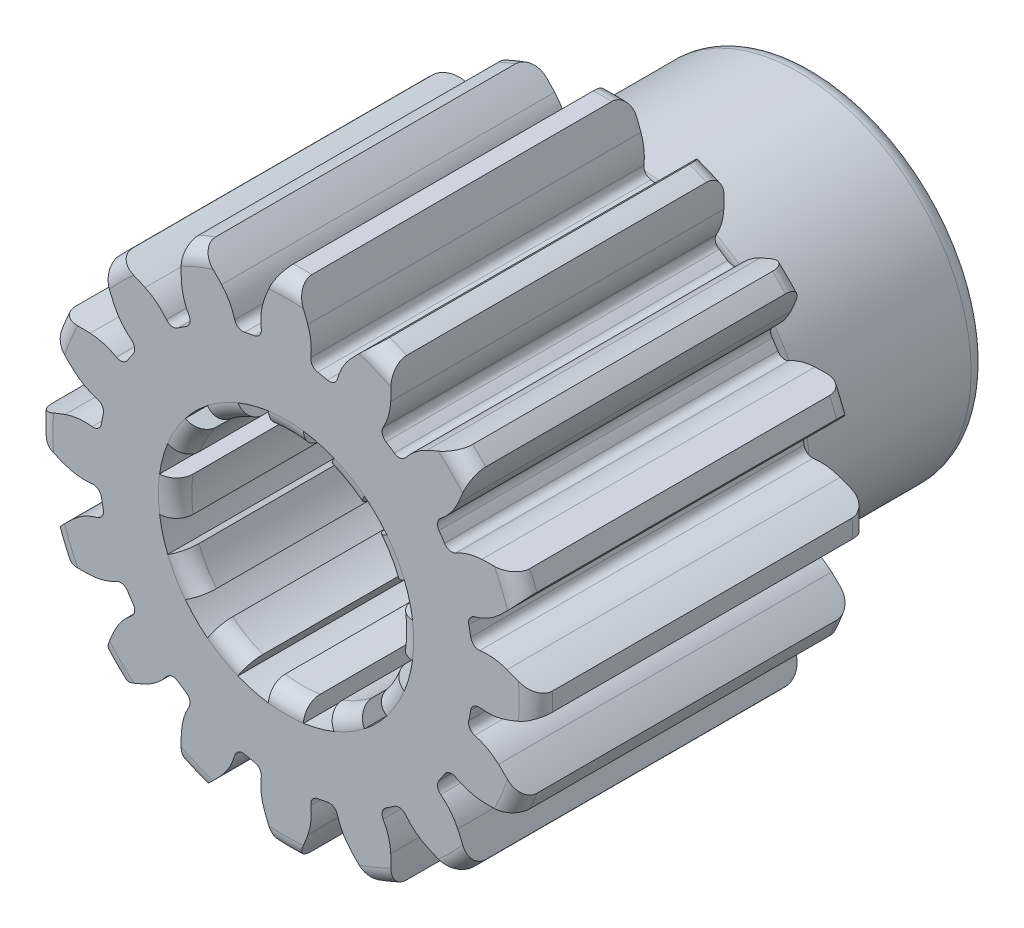
from build123d import *

# Parameters (mm, degrees)
CUT_EXTRUDE1_DEPTH = 73.71523613
CIRPATTERN1_COUNT  = 16
CUT_EXTRUDE2_REACH = 74.715


with BuildPart() as part:
    # Sketch3 → Revolve1 (revolve)
    with BuildSketch(Plane(origin=(0, 0, 0), x_dir=(0, 0, -1), z_dir=(1, 0, 0)), mode=Mode.PRIVATE) as revolve1_sk:
        with BuildLine():
            Line((28.321, 12.7), (-28.321, 12.7))
            ThreePointArc((-28.321, 12.7), (-29.668038418, 13.257961582), (-30.226, 14.605))
            Line((-30.226, 14.605), (-30.226, 26.67))
            ThreePointArc((-30.226, 26.67), (-29.668038418, 28.017038418), (-28.321, 28.575))
            Line((-28.321, 28.575), (5.969, 28.575))
            ThreePointArc((5.969, 28.575), (7.316038418, 28.017038418), (7.874, 26.67))
            Line((7.874, 26.67), (7.874, 21.717))
            ThreePointArc((7.874, 21.717), (8.431961582, 20.369961582), (9.779, 19.812))
            Line((9.779, 19.812), (28.321, 19.812))
            ThreePointArc((28.321, 19.812), (29.668038418, 19.254038418), (30.226, 17.907))
            Line((30.226, 17.907), (30.226, 14.605))
            ThreePointArc((30.226, 14.605), (29.668038418, 13.257961582), (28.321, 12.7))
        make_face()
    revolve(revolve1_sk.sketch.rotate(Axis((0, 0, -30.226), (0, 0, 1)), 90), axis=Axis((0, 0, -30.226), (0, 0, 1)))

    # Sketch4 → Cut-Extrude1 (cut, symmetric)
    with BuildSketch(Plane.XY.offset(30.226)):
        with BuildLine():
            ThreePointArc((9.954074785, 26.785201514), (5.574705952, 28.025939388), (1.053886893, 28.555558958))
            ThreePointArc((1.053886893, 28.555558958), (1.824044526, 26.93952485), (2.489641168, 25.277691486))
            ThreePointArc((2.489641168, 25.277691486), (2.847143045, 23.751026765), (2.834519928, 22.18311305))
            ThreePointArc((2.834519928, 22.18311305), (3.013653222, 21.495832145), (3.618515105, 21.123560898))
            ThreePointArc((3.618515105, 21.123560898), (4.181029464, 21.019454541), (4.740564744, 20.900371348))
            ThreePointArc((4.740564744, 20.900371348), (5.441846297, 21.012834513), (5.870354897, 21.579247929))
            ThreePointArc((5.870354897, 21.579247929), (6.45870726, 23.032641977), (7.373225222, 24.30628622))
            ThreePointArc((7.373225222, 24.30628622), (8.624112432, 25.586907244), (9.954074785, 26.785201514))
        make_face()
    cut_extrude1 = extrude(amount=CUT_EXTRUDE1_DEPTH, both=True, mode=Mode.SUBTRACT)

    # CirPattern1: Cut-Extrude1 ×16 about axis
    cirpattern1_axis = Axis((0, 0, 0), (0, 0, 1))
    for i in range(1, CIRPATTERN1_COUNT):
        add(cut_extrude1.rotate(cirpattern1_axis, i * 360 / CIRPATTERN1_COUNT), mode=Mode.SUBTRACT)

    # Sketch5 → Cut-Extrude2 (cut, up to next)
    with BuildSketch(Plane(origin=(0, 0, -30.226), x_dir=(-1, 0, 0), z_dir=(0, 0, -1)), mode=Mode.PRIVATE) as cut_extrude2_sk1:
        with BuildLine():
            ThreePointArc((5.501655452, 13.529146769), (3.780052154, 14.107346693), (2, 14.467412519))
            Line((2, 14.467412519), (2, 12.541531007))
            ThreePointArc((2, 12.541531007), (3.287001873, 12.267257994), (4.538714696, 11.861284454))
            Line((4.538714696, 11.861284454), (5.501655452, 13.529146769))
        make_face()
    cut_extrude2_tool1 = extrude(cut_extrude2_sk1.sketch, amount=-CUT_EXTRUDE2_REACH, mode=Mode.PRIVATE) & part.part
    # Sketch5 → Cut-Extrude2 (cut, up to next)
    with BuildSketch(Plane(origin=(0, 0, -30.226), x_dir=(-1, 0, 0), z_dir=(0, 0, -1)), mode=Mode.PRIVATE) as cut_extrude2_sk2:
        with BuildLine():
            ThreePointArc((11.529146769, 8.965757067), (10.327294539, 10.327294539), (8.965757067, 11.529146769))
            Line((8.965757067, 11.529146769), (8.002816311, 9.861284454))
            ThreePointArc((8.002816311, 9.861284454), (8.980256121, 8.980256121), (9.861284454, 8.002816311))
            Line((9.861284454, 8.002816311), (11.529146769, 8.965757067))
        make_face()
    cut_extrude2_tool2 = extrude(cut_extrude2_sk2.sketch, amount=-CUT_EXTRUDE2_REACH, mode=Mode.PRIVATE) & part.part
    # Sketch5 → Cut-Extrude2 (cut, up to next)
    with BuildSketch(Plane(origin=(0, 0, -30.226), x_dir=(-1, 0, 0), z_dir=(0, 0, -1)), mode=Mode.PRIVATE) as cut_extrude2_sk3:
        with BuildLine():
            ThreePointArc((14.467412519, 2), (14.107346693, 3.780052154), (13.529146769, 5.501655452))
            Line((13.529146769, 5.501655452), (11.861284454, 4.538714696))
            ThreePointArc((11.861284454, 4.538714696), (12.267257994, 3.287001873), (12.541531007, 2))
            Line((12.541531007, 2), (14.467412519, 2))
        make_face()
    cut_extrude2_tool3 = extrude(cut_extrude2_sk3.sketch, amount=-CUT_EXTRUDE2_REACH, mode=Mode.PRIVATE) & part.part
    # Sketch5 → Cut-Extrude2 (cut, up to next)
    with BuildSketch(Plane(origin=(0, 0, -30.226), x_dir=(-1, 0, 0), z_dir=(0, 0, -1)), mode=Mode.PRIVATE) as cut_extrude2_sk4:
        with BuildLine():
            ThreePointArc((13.529146769, -5.501655452), (14.107346693, -3.780052154), (14.467412519, -2))
            Line((14.467412519, -2), (12.541531007, -2))
            ThreePointArc((12.541531007, -2), (12.267257994, -3.287001873), (11.861284454, -4.538714696))
            Line((11.861284454, -4.538714696), (13.529146769, -5.501655452))
        make_face()
    cut_extrude2_tool4 = extrude(cut_extrude2_sk4.sketch, amount=-CUT_EXTRUDE2_REACH, mode=Mode.PRIVATE) & part.part
    # Sketch5 → Cut-Extrude2 (cut, up to next)
    with BuildSketch(Plane(origin=(0, 0, -30.226), x_dir=(-1, 0, 0), z_dir=(0, 0, -1)), mode=Mode.PRIVATE) as cut_extrude2_sk5:
        with BuildLine():
            ThreePointArc((8.965757067, -11.529146769), (10.327294539, -10.327294539), (11.529146769, -8.965757067))
            Line((11.529146769, -8.965757067), (9.861284454, -8.002816311))
            ThreePointArc((9.861284454, -8.002816311), (8.980256121, -8.980256121), (8.002816311, -9.861284454))
            Line((8.002816311, -9.861284454), (8.965757067, -11.529146769))
        make_face()
    cut_extrude2_tool5 = extrude(cut_extrude2_sk5.sketch, amount=-CUT_EXTRUDE2_REACH, mode=Mode.PRIVATE) & part.part
    # Sketch5 → Cut-Extrude2 (cut, up to next)
    with BuildSketch(Plane(origin=(0, 0, -30.226), x_dir=(-1, 0, 0), z_dir=(0, 0, -1)), mode=Mode.PRIVATE) as cut_extrude2_sk6:
        with BuildLine():
            ThreePointArc((2, -14.467412519), (3.780052154, -14.107346693), (5.501655452, -13.529146769))
            Line((5.501655452, -13.529146769), (4.538714696, -11.861284454))
            ThreePointArc((4.538714696, -11.861284454), (3.287001873, -12.267257994), (2, -12.541531007))
            Line((2, -12.541531007), (2, -14.467412519))
        make_face()
    cut_extrude2_tool6 = extrude(cut_extrude2_sk6.sketch, amount=-CUT_EXTRUDE2_REACH, mode=Mode.PRIVATE) & part.part
    # Sketch5 → Cut-Extrude2 (cut, up to next)
    with BuildSketch(Plane(origin=(0, 0, -30.226), x_dir=(-1, 0, 0), z_dir=(0, 0, -1)), mode=Mode.PRIVATE) as cut_extrude2_sk7:
        with BuildLine():
            Line((-4.538714696, -11.861284454), (-5.501655452, -13.529146769))
            ThreePointArc((-5.501655452, -13.529146769), (-3.780052154, -14.107346693), (-2, -14.467412519))
            Line((-2, -14.467412519), (-2, -12.541531007))
            ThreePointArc((-2, -12.541531007), (-3.287001873, -12.267257994), (-4.538714696, -11.861284454))
        make_face()
    cut_extrude2_tool7 = extrude(cut_extrude2_sk7.sketch, amount=-CUT_EXTRUDE2_REACH, mode=Mode.PRIVATE) & part.part
    # Sketch5 → Cut-Extrude2 (cut, up to next)
    with BuildSketch(Plane(origin=(0, 0, -30.226), x_dir=(-1, 0, 0), z_dir=(0, 0, -1)), mode=Mode.PRIVATE) as cut_extrude2_sk8:
        with BuildLine():
            Line((-9.861284454, -8.002816311), (-11.529146769, -8.965757067))
            ThreePointArc((-11.529146769, -8.965757067), (-10.327294539, -10.327294539), (-8.965757067, -11.529146769))
            Line((-8.965757067, -11.529146769), (-8.002816311, -9.861284454))
            ThreePointArc((-8.002816311, -9.861284454), (-8.980256121, -8.980256121), (-9.861284454, -8.002816311))
        make_face()
    cut_extrude2_tool8 = extrude(cut_extrude2_sk8.sketch, amount=-CUT_EXTRUDE2_REACH, mode=Mode.PRIVATE) & part.part
    # Sketch5 → Cut-Extrude2 (cut, up to next)
    with BuildSketch(Plane(origin=(0, 0, -30.226), x_dir=(-1, 0, 0), z_dir=(0, 0, -1)), mode=Mode.PRIVATE) as cut_extrude2_sk9:
        with BuildLine():
            Line((-12.541531007, -2), (-14.467412519, -2))
            ThreePointArc((-14.467412519, -2), (-14.107346693, -3.780052154), (-13.529146769, -5.501655452))
            Line((-13.529146769, -5.501655452), (-11.861284454, -4.538714696))
            ThreePointArc((-11.861284454, -4.538714696), (-12.267257994, -3.287001873), (-12.541531007, -2))
        make_face()
    cut_extrude2_tool9 = extrude(cut_extrude2_sk9.sketch, amount=-CUT_EXTRUDE2_REACH, mode=Mode.PRIVATE) & part.part
    # Sketch5 → Cut-Extrude2 (cut, up to next)
    with BuildSketch(Plane(origin=(0, 0, -30.226), x_dir=(-1, 0, 0), z_dir=(0, 0, -1)), mode=Mode.PRIVATE) as cut_extrude2_sk10:
        with BuildLine():
            Line((-11.861284454, 4.538714696), (-13.529146769, 5.501655452))
            ThreePointArc((-13.529146769, 5.501655452), (-14.107346693, 3.780052154), (-14.467412519, 2))
            Line((-14.467412519, 2), (-12.541531007, 2))
            ThreePointArc((-12.541531007, 2), (-12.267257994, 3.287001873), (-11.861284454, 4.538714696))
        make_face()
    cut_extrude2_tool10 = extrude(cut_extrude2_sk10.sketch, amount=-CUT_EXTRUDE2_REACH, mode=Mode.PRIVATE) & part.part
    # Sketch5 → Cut-Extrude2 (cut, up to next)
    with BuildSketch(Plane(origin=(0, 0, -30.226), x_dir=(-1, 0, 0), z_dir=(0, 0, -1)), mode=Mode.PRIVATE) as cut_extrude2_sk11:
        with BuildLine():
            Line((-8.002816311, 9.861284454), (-8.965757067, 11.529146769))
            ThreePointArc((-8.965757067, 11.529146769), (-10.327294539, 10.327294539), (-11.529146769, 8.965757067))
            Line((-11.529146769, 8.965757067), (-9.861284454, 8.002816311))
            ThreePointArc((-9.861284454, 8.002816311), (-8.980256121, 8.980256121), (-8.002816311, 9.861284454))
        make_face()
    cut_extrude2_tool11 = extrude(cut_extrude2_sk11.sketch, amount=-CUT_EXTRUDE2_REACH, mode=Mode.PRIVATE) & part.part
    # Sketch5 → Cut-Extrude2 (cut, up to next)
    with BuildSketch(Plane(origin=(0, 0, -30.226), x_dir=(-1, 0, 0), z_dir=(0, 0, -1)), mode=Mode.PRIVATE) as cut_extrude2_sk12:
        with BuildLine():
            Line((-2, 12.541531007), (-2, 14.467412519))
            ThreePointArc((-2, 14.467412519), (-3.780052154, 14.107346693), (-5.501655452, 13.529146769))
            Line((-5.501655452, 13.529146769), (-4.538714696, 11.861284454))
            ThreePointArc((-4.538714696, 11.861284454), (-3.287001873, 12.267257994), (-2, 12.541531007))
        make_face()
    cut_extrude2_tool12 = extrude(cut_extrude2_sk12.sketch, amount=-CUT_EXTRUDE2_REACH, mode=Mode.PRIVATE) & part.part
    add(cut_extrude2_tool1.solids().sort_by_distance((-3.538781, 13.206911, -30.226))[0], mode=Mode.SUBTRACT)
    add(cut_extrude2_tool2.solids().sort_by_distance((-9.66813, 9.66813, -30.226))[0], mode=Mode.SUBTRACT)
    add(cut_extrude2_tool3.solids().sort_by_distance((-13.206911, 3.538781, -30.226))[0], mode=Mode.SUBTRACT)
    add(cut_extrude2_tool4.solids().sort_by_distance((-13.206911, -3.538781, -30.226))[0], mode=Mode.SUBTRACT)
    add(cut_extrude2_tool5.solids().sort_by_distance((-9.66813, -9.66813, -30.226))[0], mode=Mode.SUBTRACT)
    add(cut_extrude2_tool6.solids().sort_by_distance((-3.538781, -13.206911, -30.226))[0], mode=Mode.SUBTRACT)
    add(cut_extrude2_tool7.solids().sort_by_distance((3.538781, -13.206911, -30.226))[0], mode=Mode.SUBTRACT)
    add(cut_extrude2_tool8.solids().sort_by_distance((9.66813, -9.66813, -30.226))[0], mode=Mode.SUBTRACT)
    add(cut_extrude2_tool9.solids().sort_by_distance((13.206911, -3.538781, -30.226))[0], mode=Mode.SUBTRACT)
    add(cut_extrude2_tool10.solids().sort_by_distance((13.206911, 3.538781, -30.226))[0], mode=Mode.SUBTRACT)
    add(cut_extrude2_tool11.solids().sort_by_distance((9.66813, 9.66813, -30.226))[0], mode=Mode.SUBTRACT)
    add(cut_extrude2_tool12.solids().sort_by_distance((3.538781, 13.206911, -30.226))[0], mode=Mode.SUBTRACT)


solid = part.part
